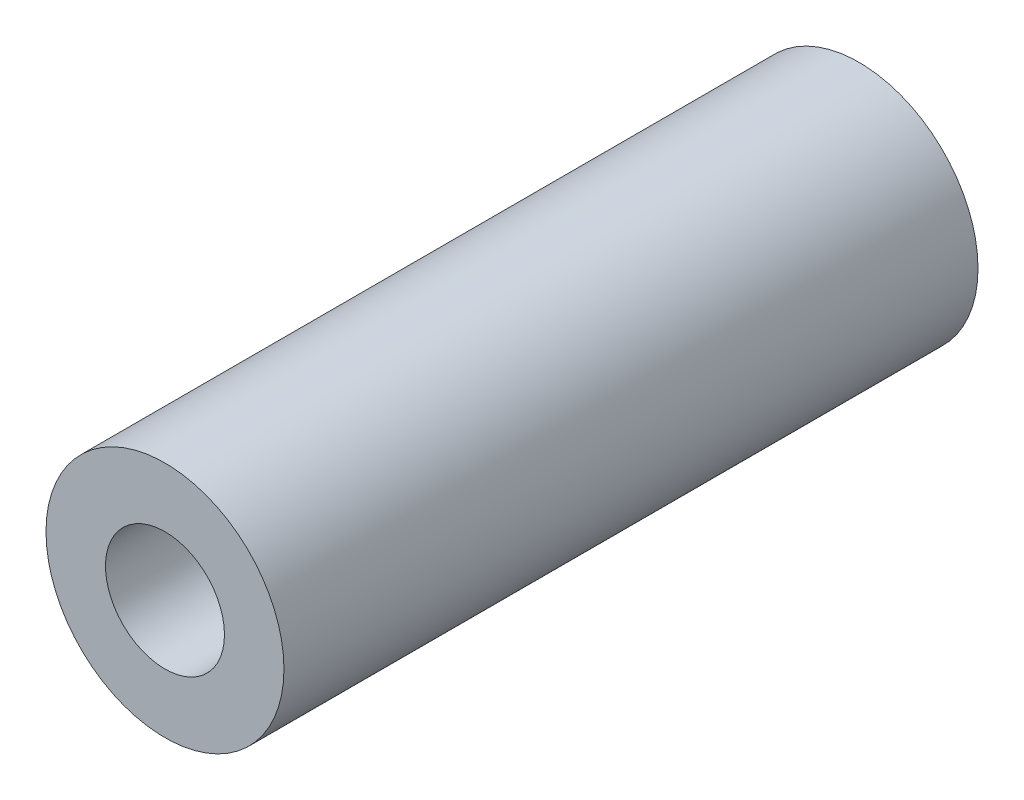
from build123d import *

# Parameters (mm, degrees)
CROQUIS1_R              = 6
CROQUIS1_R_2            = 3
SALIENTE_EXTRUIR3_DEPTH = 35
CROQUIS1_4_R            = 3
CROQUIS1_4_R_2          = 1.5
SALIENTE_EXTRUIR4_DEPTH = 5


with BuildPart() as part:
    # Croquis1 → Saliente-Extruir3 (new body)
    with BuildSketch(Plane.XY):
        Circle(CROQUIS1_R)
        Circle(CROQUIS1_R_2, mode=Mode.SUBTRACT)
    extrude(amount=SALIENTE_EXTRUIR3_DEPTH)

    # Croquis1<4> → Saliente-Extruir4 (add)
    with BuildSketch(Plane.XY):
        Circle(CROQUIS1_4_R)
        Circle(CROQUIS1_4_R_2, mode=Mode.SUBTRACT)
    extrude(amount=SALIENTE_EXTRUIR4_DEPTH)


solid = part.part
